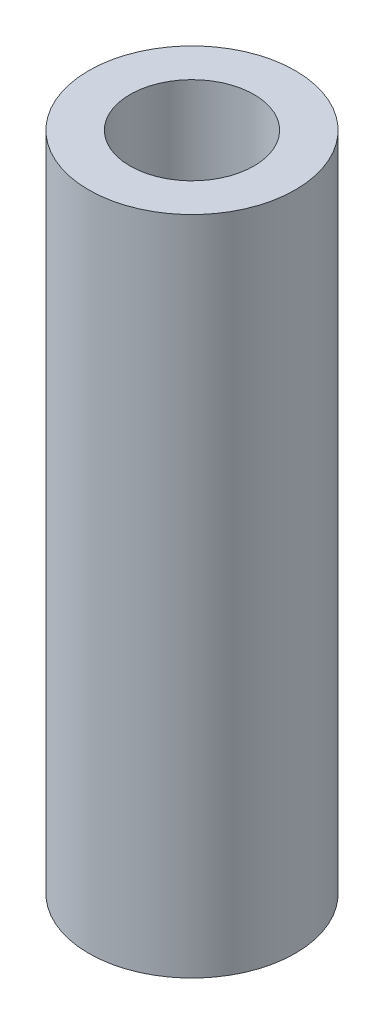
from build123d import *

# Parameters (mm, degrees)
SKETCH_1_R      = 2.5
SKETCH_1_R_2    = 1.5
EXTRUDE_1_DEPTH = 16


with BuildPart() as part:
    # 草图1 → 凸台-拉伸1 (new body)
    with BuildSketch(Plane(origin=(0, 0, 0), x_dir=(1, 0, 0), z_dir=(0, 1, 0))):
        with Locations(Location((0, 0, 0), (0, 0, 270))):
            Circle(SKETCH_1_R)
        with Locations(Location((0, 0, 0), (0, 0, 270))):
            Circle(SKETCH_1_R_2, mode=Mode.SUBTRACT)
    extrude(amount=EXTRUDE_1_DEPTH)


solid = part.part
